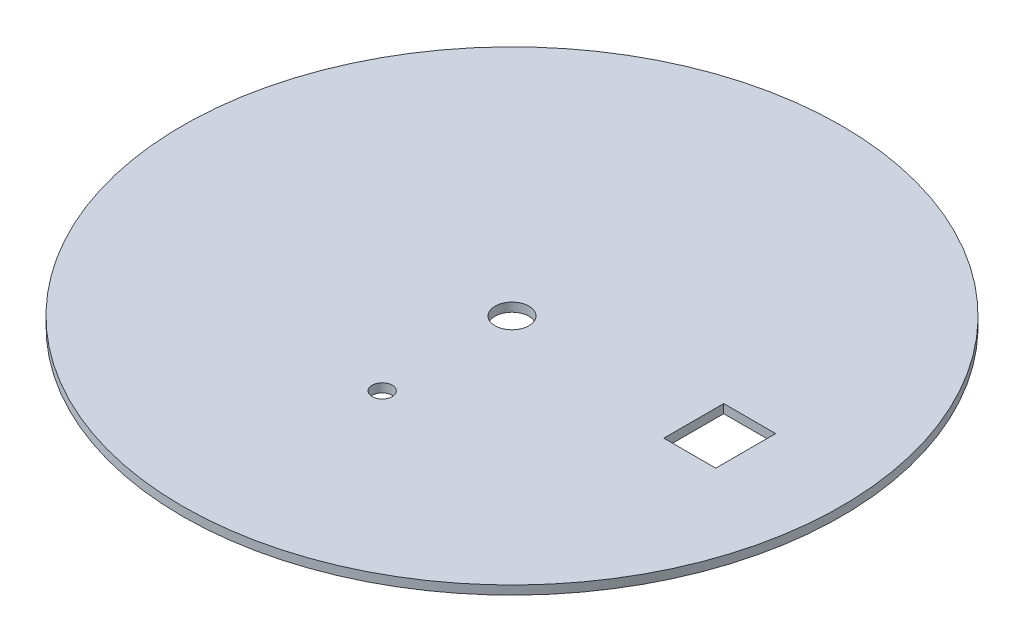
from build123d import *

# Parameters (mm, degrees)
SKETCH1_R           = 16.5
BOSS_EXTRUDE1_DEPTH = 0.44
SKETCH2_R           = 0.85
CUT_EXTRUDE1_DEPTH  = 0.44
SKETCH3_R           = 0.5
SKETCH3_W           = 2.6
SKETCH3_H           = 3
CUT_EXTRUDE4_DEPTH  = 0.44


with BuildPart() as part:
    # Sketch1 → Boss-Extrude1 (new body)
    with BuildSketch(Plane(origin=(0, 0, 0), x_dir=(1, 0, 0), z_dir=(0, 1, 0))):
        with Locations(Location((0, 0, 0), (0, 0, 270))):
            Circle(SKETCH1_R)
    extrude(amount=BOSS_EXTRUDE1_DEPTH)

    # Sketch2 → Cut-Extrude1 (cut)
    with BuildSketch(Plane(origin=(0, 0.44, 0), x_dir=(1, 0, 0), z_dir=(0, 1, 0))):
        with Locations(Location((0, 0, 0), (0, 0, 270))):
            Circle(SKETCH2_R)
    extrude(amount=-CUT_EXTRUDE1_DEPTH, mode=Mode.SUBTRACT)

    # Sketch3 → Cut-Extrude4 (cut)
    with BuildSketch(Plane(origin=(0, 0.44, 0), x_dir=(1, 0, 0), z_dir=(0, 1, 0))):
        with Locations(Location((0, -6.5, 0), (0, 0, 270))):
            Circle(SKETCH3_R)
        with Locations((10.4, 0)):
            Rectangle(SKETCH3_W, SKETCH3_H)
    extrude(amount=-CUT_EXTRUDE4_DEPTH, mode=Mode.SUBTRACT)


solid = part.part
